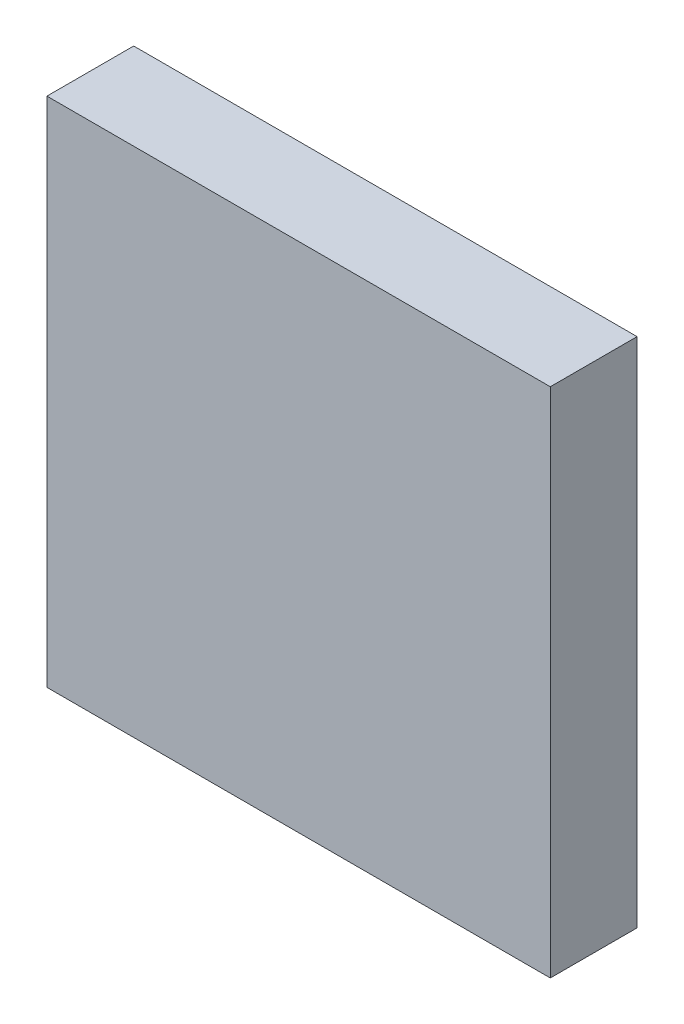
from build123d import *

# Parameters (mm, degrees)
ESQUISSE1_W        = 58
ESQUISSE1_H        = 59
BOSS_EXTRU_1_DEPTH = 10


with BuildPart() as part:
    # Esquisse1 → Boss.-Extru.1 (new body)
    with BuildSketch(Plane.XY):
        with Locations((-1.846019501, -10.830065359)):
            Rectangle(ESQUISSE1_W, ESQUISSE1_H)
    extrude(amount=BOSS_EXTRU_1_DEPTH)


solid = part.part
